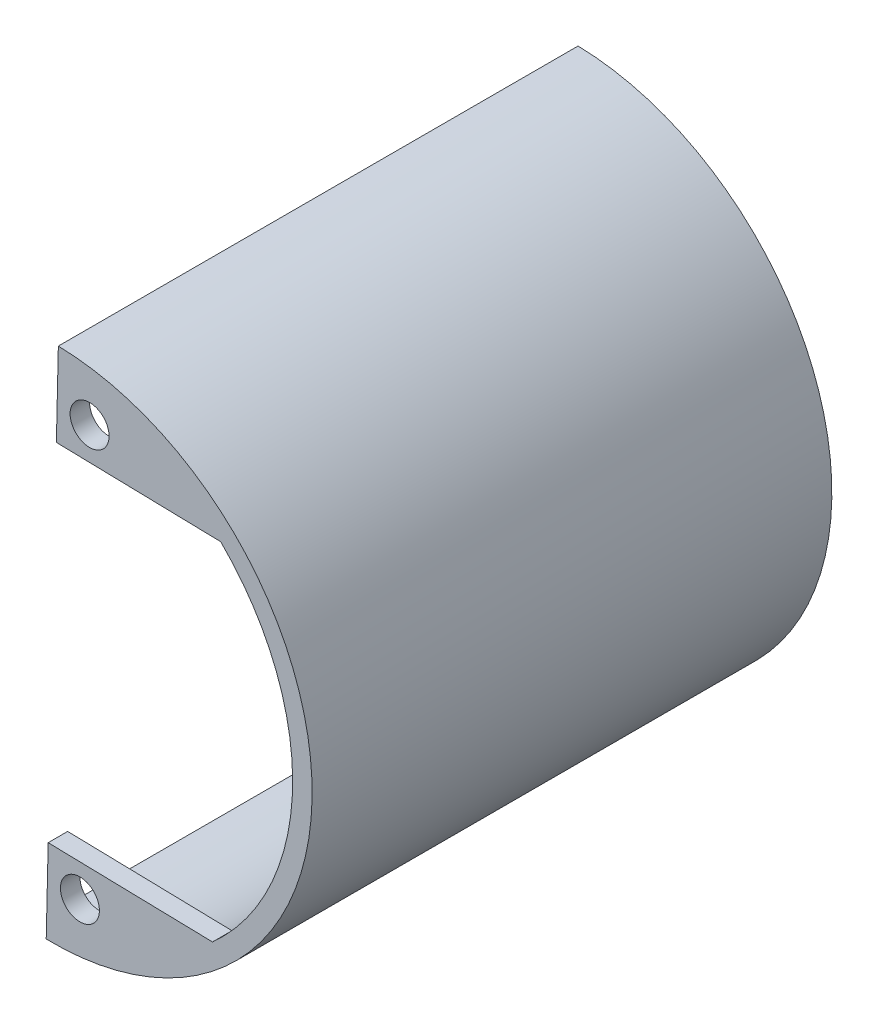
from build123d import *

# Parameters (mm, degrees)
BOSS_EXTRUDE1_DEPTH      = 80
BOSS_EXTRUDE2_REACH      = 99.98
BOSS_EXTRUDE2_END_RADIUS = 37
SKETCH4_W                = 3
SKETCH4_H                = 10
BOSS_EXTRUDE3_REACH      = 99.98
BOSS_EXTRUDE3_END_RADIUS = 37
SKETCH5_W                = 3
SKETCH5_H                = 10
SKETCH6_R                = 3
CUT_EXTRUDE1_DEPTH       = 3


with BuildPart() as part:
    # Sketch2 → Boss-Extrude1 (new body)
    with BuildSketch(Plane.XY):
        with BuildLine():
            Line((0.933575247, 39.989103982), (0.863557104, 36.989921183))
            ThreePointArc((0.863557104, 36.989921183), (36.989921183, -0.863557104), (-0.863557104, -36.989921183))
            Line((-0.863557104, -36.989921183), (-0.933575248, -39.989103982))
            ThreePointArc((-0.933575248, -39.989103982), (39.989103982, -0.933575247), (0.933575247, 39.989103982))
        make_face()
    extrude(amount=BOSS_EXTRUDE1_DEPTH)

    # Boss-Extrude2: up to this cylinder (the profile starts inside it)
    boss_extrude2_end = Plane(origin=(0, 0, 78.5), z_dir=(0, 0, -1)) * Cylinder(BOSS_EXTRUDE2_END_RADIUS, 274.96, mode=Mode.PRIVATE)
    # Sketch4 → Boss-Extrude2 (add, up to the surface)
    with BuildSketch(Plane(origin=(0, 0, 0), x_dir=(0, 0, 1), z_dir=(-0.9997275995418874, 0.02333938118750909, 0)), mode=Mode.PRIVATE) as boss_extrude2_sk1:
        with Locations((78.5, -32)):
            Rectangle(SKETCH4_W, SKETCH4_H)
    boss_extrude2_tool1 = extrude(boss_extrude2_sk1.sketch, amount=-BOSS_EXTRUDE2_REACH, mode=Mode.PRIVATE) & boss_extrude2_end
    add(boss_extrude2_tool1.solids().sort_by_distance((-0.74686, -31.991283, 78.5))[0])

    # Boss-Extrude3: up to this cylinder (the profile starts inside it)
    boss_extrude3_end = Plane(origin=(0, 0, 78.5), z_dir=(0, 0, -1)) * Cylinder(BOSS_EXTRUDE3_END_RADIUS, 274.96, mode=Mode.PRIVATE)
    # Sketch5 → Boss-Extrude3 (add, up to the surface)
    with BuildSketch(Plane(origin=(0, 0, 0), x_dir=(0, 0, 1), z_dir=(-0.9997275995418874, 0.02333938118750974, 0)), mode=Mode.PRIVATE) as boss_extrude3_sk1:
        with Locations((78.5, 32)):
            Rectangle(SKETCH5_W, SKETCH5_H)
    boss_extrude3_tool1 = extrude(boss_extrude3_sk1.sketch, amount=-BOSS_EXTRUDE3_REACH, mode=Mode.PRIVATE) & boss_extrude3_end
    add(boss_extrude3_tool1.solids().sort_by_distance((0.74686, 31.991283, 78.5))[0])

    # Sketch6 → Cut-Extrude1 (cut)
    with BuildSketch(Plane(origin=(0, 0, 77), x_dir=(-1, 0, 0), z_dir=(0, 0, -1))):
        with Locations((-5.745498196, 31.874586279)):
            Circle(SKETCH6_R)
        with Locations((-4.2517778, -32.107980091)):
            Circle(SKETCH6_R)
    extrude(amount=-CUT_EXTRUDE1_DEPTH, mode=Mode.SUBTRACT)


solid = part.part
